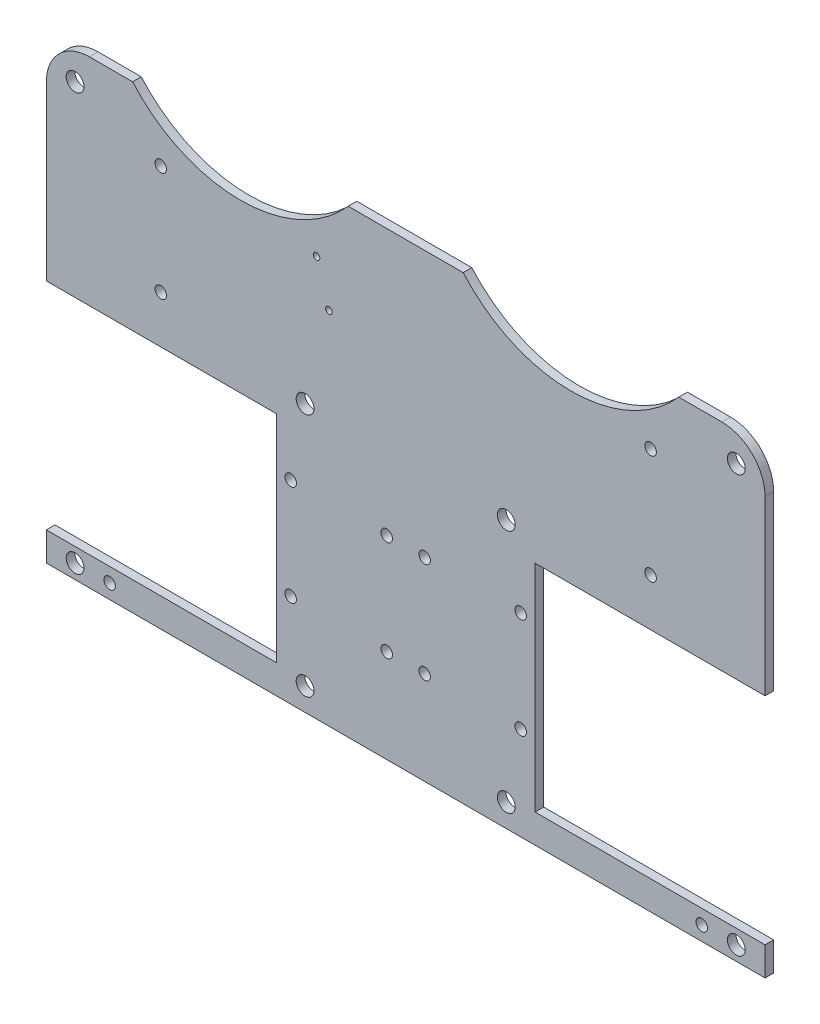
from build123d import *

# Parameters (mm, degrees)
ESQUISSE1_W              = 250
ESQUISSE1_H              = 210
ESQUISSE1_R              = 1.143
ESQUISSE1_R_2            = 1.134386863
BOSS_EXTRU_1_DEPTH       = 3
ESQUISSE2_R              = 2.5
ESQUISSE2_R_2            = 2
ENL_V_MAT_EXTRU_1_DEPTH  = 5
ESQUISSE3_W              = 250
ESQUISSE3_H              = 50
ENL_V_MAT_EXTRU_2_DEPTH  = 5
ESQUISSE10_W             = 80
ESQUISSE10_H             = 75
ENL_V_MAT_EXTRU_7_DEPTH  = 10
ESQUISSE12_R             = 2
ENL_V_MAT_EXTRU_8_DEPTH  = 13
ESQUISSE18_R             = 2
ENL_V_MAT_EXTRU_13_DEPTH = 10
ESQUISSE19_R             = 3.1
ENL_V_MAT_EXTRU_14_DEPTH = 10
ESQUISSE21_R             = 3.1
ENL_V_MAT_EXTRU_16_DEPTH = 10
ENL_V_MAT_EXTRU_17_DEPTH = 10
ENL_V_MAT_EXTRU_18_DEPTH = 10


with BuildPart() as part:
    # Esquisse1 → Boss.-Extru.1 (new body)
    with BuildSketch(Plane.XY):
        with Locations((125, -105)):
            Rectangle(ESQUISSE1_W, ESQUISSE1_H)
        with Locations((94.002297733, -70.627273701)):
            Circle(ESQUISSE1_R, mode=Mode.SUBTRACT)
        with Locations((98.297909971, -84.719098973)):
            Circle(ESQUISSE1_R_2, mode=Mode.SUBTRACT)
    extrude(amount=BOSS_EXTRU_1_DEPTH)

    # Esquisse2 → Enlèv. mat.-Extru.1 (cut)
    with BuildSketch(Plane.XY.offset(3)):
        with Locations((18, -137)):
            Circle(ESQUISSE2_R)
        with Locations((18, -188)):
            Circle(ESQUISSE2_R)
        with Locations((85, -142.5)):
            Circle(ESQUISSE2_R_2)
        with Locations((118.4, -142.5)):
            Circle(ESQUISSE2_R_2)
        with Locations((118.4, -177.5)):
            Circle(ESQUISSE2_R_2)
        with Locations((85, -177.5)):
            Circle(ESQUISSE2_R_2)
        with Locations((131.6, -177.5)):
            Circle(ESQUISSE2_R_2)
        with Locations((165, -177.5)):
            Circle(ESQUISSE2_R_2)
        with Locations((165, -142.5)):
            Circle(ESQUISSE2_R_2)
        with Locations((131.6, -142.5)):
            Circle(ESQUISSE2_R_2)
        with Locations((232, -188)):
            Circle(ESQUISSE2_R)
        with Locations((232, -137)):
            Circle(ESQUISSE2_R)
    extrude(amount=-ENL_V_MAT_EXTRU_1_DEPTH, mode=Mode.SUBTRACT)

    # Esquisse3 → Enlèv. mat.-Extru.2 (cut)
    with BuildSketch(Plane.XY.offset(3)):
        with Locations((125, -25)):
            Rectangle(ESQUISSE3_W, ESQUISSE3_H)
    extrude(amount=-ENL_V_MAT_EXTRU_2_DEPTH, mode=Mode.SUBTRACT)

    # Esquisse10 → Enlèv. mat.-Extru.7 (cut)
    with BuildSketch(Plane.XY.offset(3)):
        with Locations((40, -162.5)):
            Rectangle(ESQUISSE10_W, ESQUISSE10_H)
        with Locations((210, -162.5)):
            Rectangle(ESQUISSE10_W, ESQUISSE10_H)
    extrude(amount=-ENL_V_MAT_EXTRU_7_DEPTH, mode=Mode.SUBTRACT)

    # Esquisse12 → Enlèv. mat.-Extru.8 (cut)
    with BuildSketch(Plane.XY.offset(3)):
        with Locations((39.8, -108.5)):
            Circle(ESQUISSE12_R)
        with Locations((39.8, -70.5)):
            Circle(ESQUISSE12_R)
        with Locations((210.2, -108.5)):
            Circle(ESQUISSE12_R)
        with Locations((210.2, -70.5)):
            Circle(ESQUISSE12_R)
    extrude(amount=-ENL_V_MAT_EXTRU_8_DEPTH, mode=Mode.SUBTRACT)

    # Esquisse18 → Enlèv. mat.-Extru.13 (cut)
    with BuildSketch(Plane.XY.offset(3)):
        with Locations((22, -205)):
            Circle(ESQUISSE18_R)
        with Locations((228, -205)):
            Circle(ESQUISSE18_R)
    extrude(amount=-ENL_V_MAT_EXTRU_13_DEPTH, mode=Mode.SUBTRACT)

    # Esquisse19 → Enlèv. mat.-Extru.14 (cut)
    with BuildSketch(Plane.XY.offset(3)):
        with Locations((90, -117)):
            Circle(ESQUISSE19_R)
        with Locations((90, -202)):
            Circle(ESQUISSE19_R)
        with Locations((160, -202)):
            Circle(ESQUISSE19_R)
        with Locations((160, -117)):
            Circle(ESQUISSE19_R)
    extrude(amount=-ENL_V_MAT_EXTRU_14_DEPTH, mode=Mode.SUBTRACT)

    # Esquisse21 → Enlèv. mat.-Extru.16 (cut)
    with BuildSketch(Plane.XY.offset(3)):
        with Locations((10, -60)):
            Circle(ESQUISSE21_R)
        with Locations((10, -205)):
            Circle(ESQUISSE21_R)
        with Locations((240, -205)):
            Circle(ESQUISSE21_R)
        with Locations((240, -60)):
            Circle(ESQUISSE21_R)
    extrude(amount=-ENL_V_MAT_EXTRU_16_DEPTH, mode=Mode.SUBTRACT)

    # Esquisse23 → Enlèv. mat.-Extru.17 (cut)
    with BuildSketch(Plane.XY.offset(3)):
        with BuildLine():
            Line((15, -50), (0, -50))
            Line((0, -50), (0, -65))
            ThreePointArc((0, -65), (4.393398282, -54.393398282), (15, -50))
        make_face()
        with BuildLine():
            Line((250, -50), (235, -50))
            ThreePointArc((235, -50), (245.606601718, -54.393398282), (250, -65))
            Line((250, -65), (250, -50))
        make_face()
    extrude(amount=-ENL_V_MAT_EXTRU_17_DEPTH, mode=Mode.SUBTRACT)

    # Esquisse24 → Enlèv. mat.-Extru.18 (cut)
    with BuildSketch(Plane.XY.offset(3)):
        with BuildLine():
            Line((30, -50), (105, -50))
            ThreePointArc((105, -50), (67.5, -66.928108612), (30, -50))
        make_face()
        with BuildLine():
            Line((145, -50), (220, -50))
            ThreePointArc((220, -50), (182.5, -66.928108612), (145, -50))
        make_face()
    extrude(amount=-ENL_V_MAT_EXTRU_18_DEPTH, mode=Mode.SUBTRACT)


solid = part.part
